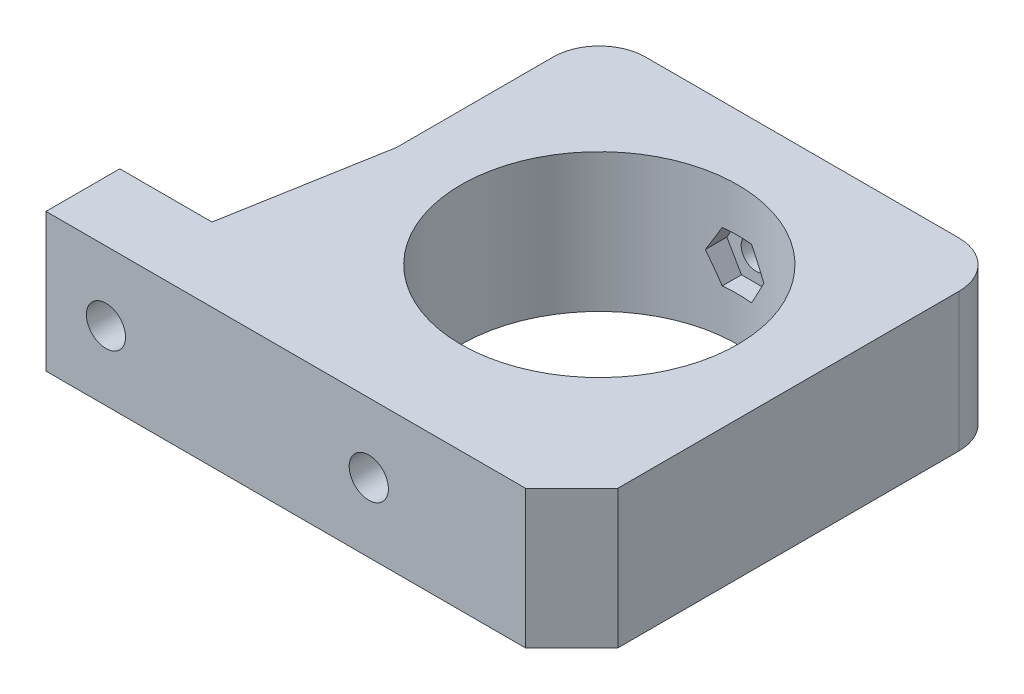
from build123d import *

# Parameters (mm, degrees)
CROQUIS1_R              = 15
SALIENTE_EXTRUIR1_DEPTH = 15
CORTAR_EXTRUIR1_REACH   = 62.49
CROQUIS2_R              = 2.125
CORTAR_EXTRUIR2_DEPTH   = 3
CUT_EXTRUDE1_DEPTH      = 46.552167984
CUT_EXTRUDE2_REACH      = 66.49
CUT_EXTRUDE2_END_RADIUS = 15
CUT_EXTRUDE2_START      = -4
CUT_EXTRUDE3_START      = -39
CUT_EXTRUDE3_DEPTH      = 3
BOSS_EXTRUDE3_START     = -15
BOSS_EXTRUDE3_DEPTH     = 15
CUT_EXTRUDE4_START      = -20
SKETCH4_R               = 1.625
CUT_EXTRUDE4_DEPTH      = 41.489668539


with BuildPart() as part:
    # Croquis1 → Saliente-Extruir1 (new body)
    with BuildSketch(Plane(origin=(0, 0, 0), x_dir=(1, 0, 0), z_dir=(0, 1, 0))):
        with BuildLine():
            Line((-35, -17), (-35, -25))
            Line((-35, -25), (35, -25))
            Line((35, -25), (35, -17))
            Line((35, -17), (25, -17))
            Line((25, -17), (22, 0))
            ThreePointArc((22, 0), (0, 22), (-22, 0))
            Line((-22, 0), (-25, -17))
            Line((-25, -17), (-35, -17))
        make_face()
        with Locations(Location((0, 0, 0), (0, 0, 270))):
            Circle(CROQUIS1_R, mode=Mode.SUBTRACT)
    extrude(amount=SALIENTE_EXTRUIR1_DEPTH)

    # Croquis2 → Cortar-Extruir1 (cut, up to next)
    with BuildSketch(Plane.XY.offset(25), mode=Mode.PRIVATE) as cortar_extruir1_sk1:
        with Locations((-28.5, 7.5)):
            Circle(CROQUIS2_R)
    cortar_extruir1_tool1 = extrude(cortar_extruir1_sk1.sketch, amount=-CORTAR_EXTRUIR1_REACH, mode=Mode.PRIVATE) & part.part
    # Croquis2 → Cortar-Extruir1 (cut, up to next)
    with BuildSketch(Plane.XY.offset(25), mode=Mode.PRIVATE) as cortar_extruir1_sk2:
        with Locations((28.5, 7.5)):
            Circle(CROQUIS2_R)
    cortar_extruir1_tool2 = extrude(cortar_extruir1_sk2.sketch, amount=-CORTAR_EXTRUIR1_REACH, mode=Mode.PRIVATE) & part.part
    # Croquis2 → Cortar-Extruir1 (cut, up to next)
    with BuildSketch(Plane.XY.offset(25), mode=Mode.PRIVATE) as cortar_extruir1_sk3:
        with Locations((0, 7.5)):
            Circle(CROQUIS2_R)
    cortar_extruir1_tool3 = extrude(cortar_extruir1_sk3.sketch, amount=-CORTAR_EXTRUIR1_REACH, mode=Mode.PRIVATE) & part.part
    add(cortar_extruir1_tool1.solids().sort_by_distance((-28.5, 7.5, 25))[0], mode=Mode.SUBTRACT)
    add(cortar_extruir1_tool2.solids().sort_by_distance((28.5, 7.5, 25))[0], mode=Mode.SUBTRACT)
    add(cortar_extruir1_tool3.solids().sort_by_distance((0, 7.5, 25))[0], mode=Mode.SUBTRACT)

    # Croquis3 → Cortar-Extruir2 (cut)
    with BuildSketch(Plane(origin=(0, 0, 17), x_dir=(-1, 0, 0), z_dir=(0, 0, -1))):
        Polygon((25, 5.479274058), (28.5, 3.458548116), (32, 5.479274058), (32, 9.520725942), (28.5, 11.541451884), (25, 9.520725942), align=None)
        Polygon((-25, 5.479274058), (-25, 9.520725942), (-28.5, 11.541451884), (-32, 9.520725942), (-32, 5.479274058), (-28.5, 3.458548116), align=None)
    extrude(amount=-CORTAR_EXTRUIR2_DEPTH, mode=Mode.SUBTRACT)

    # Sketch1 → Cut-Extrude1 (cut, through all)
    with BuildSketch(Plane(origin=(0, 15, 0), x_dir=(1, 0, 0), z_dir=(0, 1, 0))):
        Polygon((22, -25), (22, -20), (17, -25), align=None)
        Polygon((22, 0), (22, -20), (22, -25), (35, -25), (35, -17), (25, -17), align=None)
    extrude(amount=-CUT_EXTRUDE1_DEPTH, mode=Mode.SUBTRACT)

    # Cut-Extrude2: up to this cylinder (the profile starts outside it)
    cut_extrude2_end = Plane(origin=(0, 7.5, 0), z_dir=(0, -1, 0)) * Cylinder(CUT_EXTRUDE2_END_RADIUS, 163.98, mode=Mode.PRIVATE)
    # Sketch2 → Cut-Extrude2 (cut, up to the surface)
    with BuildSketch(Plane.XY.offset(25).offset(CUT_EXTRUDE2_START), mode=Mode.PRIVATE) as cut_extrude2_sk1:
        Polygon((2.020725942, 4), (4.041451884, 7.5), (2.020725942, 11), (-2.020725942, 11), (-4.041451884, 7.5), (-2.020725942, 4), align=None)
    cut_extrude2_tool1 = extrude(cut_extrude2_sk1.sketch, amount=-CUT_EXTRUDE2_REACH, mode=Mode.PRIVATE) - cut_extrude2_end
    add(cut_extrude2_tool1.solids().sort_by_distance((0, 7.5, 21))[0], mode=Mode.SUBTRACT)

    # Sketch3 → Cut-Extrude3 (cut)
    with BuildSketch(Plane.XY.offset(25).offset(CUT_EXTRUDE3_START)):
        Polygon((1.58771324, 4.75), (3.175426481, 7.5), (1.58771324, 10.25), (-1.58771324, 10.25), (-3.175426481, 7.5), (-1.58771324, 4.75), align=None)
    extrude(amount=-CUT_EXTRUDE3_DEPTH, mode=Mode.SUBTRACT)

    # Sketch5 → Boss-Extrude3 (add)
    with BuildSketch(Plane(origin=(0, 15, 0), x_dir=(1, 0, 0), z_dir=(0, 1, 0)).offset(BOSS_EXTRUDE3_START)):
        with BuildLine():
            ThreePointArc((-12.177948568, 18.322051432), (-6.36061571, 21.060450323), (3.35e-07, 22))
            Line((3.35e-07, 22), (-17, 22))
            ThreePointArc((-17, 22), (-13.967695362, 20.975566448), (-12.177948568, 18.322051432))
        make_face()
        with BuildLine():
            ThreePointArc((12.177948568, 18.322051432), (13.967695362, 20.975566448), (17, 22))
            Line((17, 22), (3.35e-07, 22))
            ThreePointArc((3.35e-07, 22), (6.360616031, 21.060450226), (12.177948568, 18.322051432))
        make_face()
        with BuildLine():
            ThreePointArc((18.322051432, 12.177948568), (20.975566448, 13.967695362), (22, 17))
            ThreePointArc((22, 17), (20.535533906, 20.535533906), (17, 22))
            ThreePointArc((17, 22), (13.967695362, 20.975566448), (12.177948568, 18.322051432))
            ThreePointArc((12.177948568, 18.322051432), (15.556349186, 15.556349186), (18.322051432, 12.177948568))
        make_face()
        with BuildLine():
            ThreePointArc((12.177948568, 18.322051432), (13.464466094, 13.464466094), (18.322051432, 12.177948568))
            ThreePointArc((18.322051432, 12.177948568), (15.556349186, 15.556349186), (12.177948568, 18.322051432))
        make_face()
        with BuildLine():
            ThreePointArc((18.322051432, 12.177948568), (21.060450274, 6.36061587), (22, 0))
            Line((22, 0), (22, 17))
            ThreePointArc((22, 17), (20.975566448, 13.967695362), (18.322051432, 12.177948568))
        make_face()
        with BuildLine():
            ThreePointArc((-17, 22), (-20.535533906, 20.535533906), (-22, 17))
            ThreePointArc((-22, 17), (-20.975566448, 13.967695362), (-18.322051432, 12.177948568))
            ThreePointArc((-18.322051432, 12.177948568), (-15.556349186, 15.556349186), (-12.177948568, 18.322051432))
            ThreePointArc((-12.177948568, 18.322051432), (-13.967695362, 20.975566448), (-17, 22))
        make_face()
        with BuildLine():
            ThreePointArc((-12.177948568, 18.322051432), (-15.556349186, 15.556349186), (-18.322051432, 12.177948568))
            ThreePointArc((-18.322051432, 12.177948568), (-13.967695362, 13.024433552), (-12, 17))
            ThreePointArc((-12, 17), (-12.044686833, 17.666986822), (-12.177948568, 18.322051432))
        make_face()
        with BuildLine():
            Line((-22, 17), (-22, 0))
            ThreePointArc((-22, 0), (-21.060450274, 6.36061587), (-18.322051432, 12.177948568))
            ThreePointArc((-18.322051432, 12.177948568), (-20.975566448, 13.967695362), (-22, 17))
        make_face()
    extrude(amount=BOSS_EXTRUDE3_DEPTH)

    # Sketch4 → Cut-Extrude4 (cut, through all)
    with BuildSketch(Plane.XY.offset(25).offset(CUT_EXTRUDE4_START)):
        with Locations((0, 7.5)):
            Circle(SKETCH4_R)
    extrude(amount=-CUT_EXTRUDE4_DEPTH, mode=Mode.SUBTRACT)


solid = part.part
